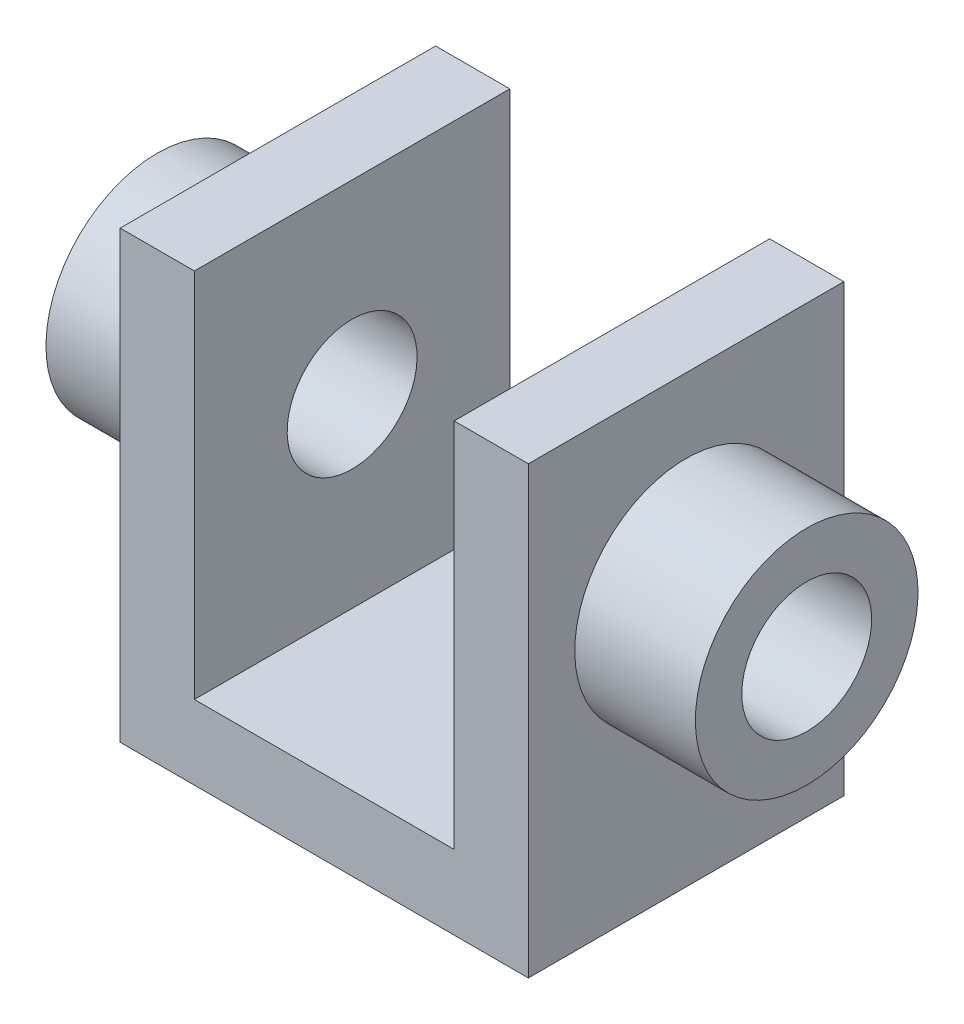
from build123d import *

# Parameters (mm, degrees)
BOSS_EXTRUDE1_DEPTH = 34
SKETCH2_R           = 12
SKETCH2_R_2         = 7
BOSS_EXTRUDE3_DEPTH = 13
BOSS_EXTRUDE5_START = -21
SKETCH4_R           = 12
SKETCH4_R_2         = 7
BOSS_EXTRUDE5_DEPTH = 21
SKETCH9_R           = 7
CUT_EXTRUDE1_DEPTH  = 8
CUT_EXTRUDE2_START  = -8
SKETCH10_R          = 7
CUT_EXTRUDE2_DEPTH  = 8


with BuildPart() as part:
    # Sketch1 → Boss-Extrude1 (new body)
    with BuildSketch(Plane.XY):
        Polygon((0, 0), (44, 0), (44, 48), (36, 48), (36, 8), (8, 8), (8, 48), (0, 48), align=None)
    extrude(amount=-BOSS_EXTRUDE1_DEPTH)

    # Sketch2 → Boss-Extrude3 (add)
    with BuildSketch(Plane.ZY):
        with Locations(Location((-17, 28, 0), (0, 0, 90))):
            Circle(SKETCH2_R)
        with Locations(Location((-17, 28, 0), (0, 0, 90))):
            Circle(SKETCH2_R_2, mode=Mode.SUBTRACT)
    extrude(amount=BOSS_EXTRUDE3_DEPTH)

    # Sketch4 → Boss-Extrude5 (add)
    with BuildSketch(Plane.ZY.offset(-36).offset(BOSS_EXTRUDE5_START)):
        with Locations(Location((-17, 28, 0), (0, 0, 90))):
            Circle(SKETCH4_R)
        with Locations(Location((-17, 28, 0), (0, 0, 90))):
            Circle(SKETCH4_R_2, mode=Mode.SUBTRACT)
    extrude(amount=BOSS_EXTRUDE5_DEPTH)

    # Sketch9 → Cut-Extrude1 (cut)
    with BuildSketch(Plane(origin=(44, 0, 0), x_dir=(0, 0, -1), z_dir=(1, 0, 0))):
        with Locations(Location((17, 28, 0), (0, 0, 90))):
            Circle(SKETCH9_R)
    extrude(amount=-CUT_EXTRUDE1_DEPTH, mode=Mode.SUBTRACT)

    # Sketch10 → Cut-Extrude2 (cut)
    with BuildSketch(Plane.ZY.offset(CUT_EXTRUDE2_START)):
        with Locations(Location((-17, 28, 0), (0, 0, 90))):
            Circle(SKETCH10_R)
    extrude(amount=CUT_EXTRUDE2_DEPTH, mode=Mode.SUBTRACT)


solid = part.part
